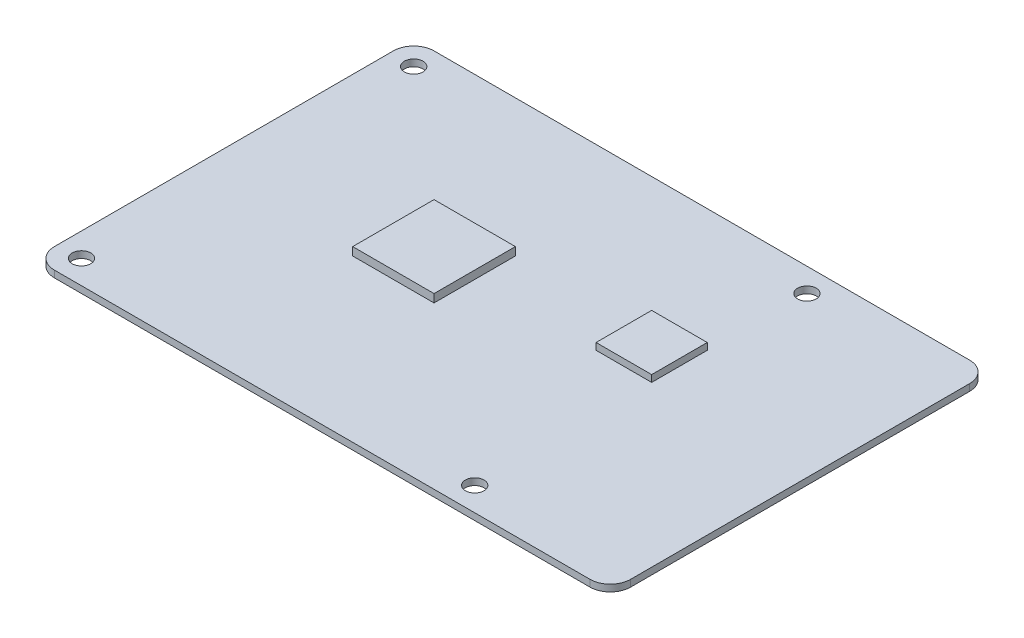
from build123d import *

# Parameters (mm, degrees)
SKETCH_1_W          = 85
SKETCH_1_H          = 56
EXTRUDE_1_DEPTH     = 1
FILLET_1_R          = 3
SKETCH_2_R          = 1.375
CUT_EXTRUDE_1_DEPTH = 51.904322017
SKETCH_3_W          = 12
SKETCH_3_H          = 12
EXTRUDE_2_DEPTH     = 1.2
SKETCH_4_W          = 8.2
SKETCH_4_H          = 8.2
EXTRUDE_3_DEPTH     = 1


with BuildPart() as part:
    # Эскиз1 → Бобышка-Вытянуть1 (new body)
    with BuildSketch(Plane(origin=(0, 0, 0), x_dir=(1, 0, 0), z_dir=(0, 1, 0))):
        Rectangle(SKETCH_1_W, SKETCH_1_H)
    extrude(amount=EXTRUDE_1_DEPTH)

    # Скругление1
    fillet_1_edges = [part.edges().sort_by_distance(p)[0] for p in [
        (-42.5, 0.5, -28),
        (42.5, 0.5, -28),
        (42.5, 0.5, 28),
        (-42.5, 0.5, 28),
    ]]
    fillet(fillet_1_edges, radius=FILLET_1_R)

    # Эскиз2 → Вырез-Вытянуть1 (cut, through all)
    with BuildSketch(Plane(origin=(0, 1, 0), x_dir=(1, 0, 0), z_dir=(0, 1, 0))):
        with Locations(Location((19, 24.5, 0), (0, 0, 270))):
            Circle(SKETCH_2_R)
        with Locations(Location((-39, 24.5, 0), (0, 0, 270))):
            Circle(SKETCH_2_R)
        with Locations(Location((-39, -24.5, 0), (0, 0, 270))):
            Circle(SKETCH_2_R)
        with Locations(Location((19, -24.5, 0), (0, 0, 270))):
            Circle(SKETCH_2_R)
    extrude(amount=-CUT_EXTRUDE_1_DEPTH, mode=Mode.SUBTRACT)

    # Эскиз3 → Бобышка-Вытянуть2 (add)
    with BuildSketch(Plane(origin=(0, 1, 0), x_dir=(1, 0, 0), z_dir=(0, 1, 0))):
        with Locations((-13.3, 1.8)):
            Rectangle(SKETCH_3_W, SKETCH_3_H)
    extrude(amount=EXTRUDE_2_DEPTH)

    # Эскиз4 → Бобышка-Вытянуть3 (add)
    with BuildSketch(Plane(origin=(0, 1, 0), x_dir=(1, 0, 0), z_dir=(0, 1, 0))):
        with Locations((14.8, 5.8)):
            Rectangle(SKETCH_4_W, SKETCH_4_H)
    extrude(amount=EXTRUDE_3_DEPTH)


solid = part.part
